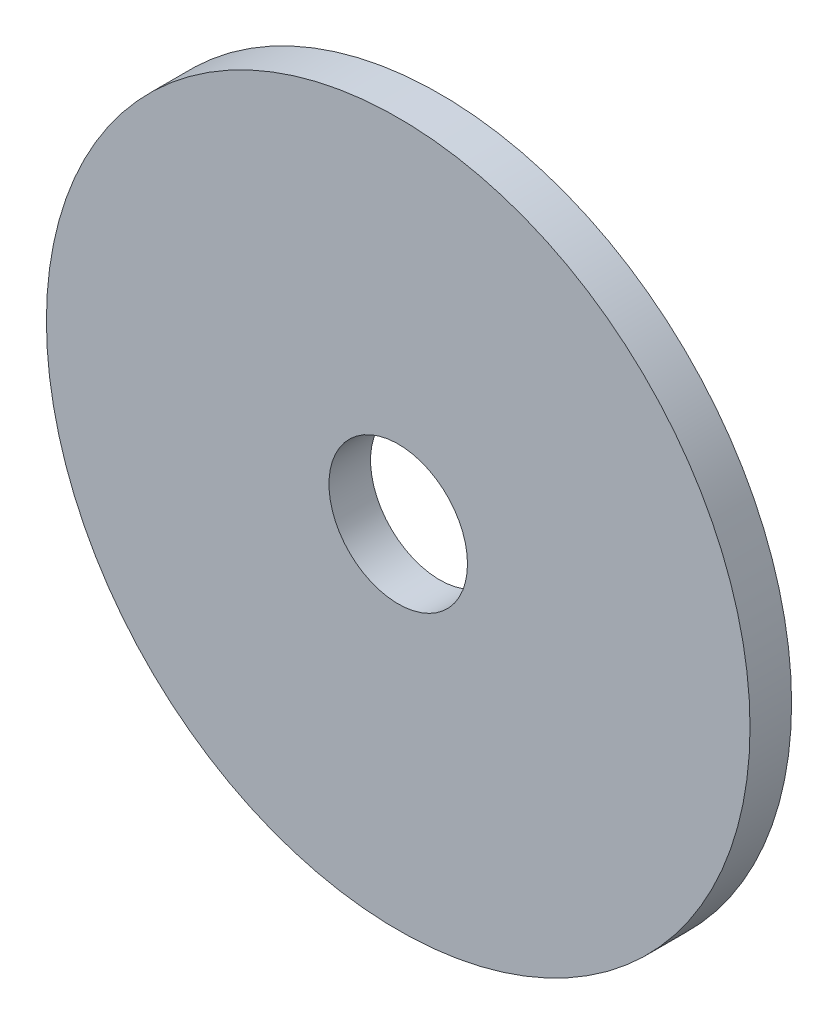
from build123d import *

# Parameters (mm, degrees)
SKETCH1_R           = 12.7
SKETCH1_R_2         = 2.5
BOSS_EXTRUDE1_DEPTH = 1.5


with BuildPart() as part:
    # Sketch1 → Boss-Extrude1 (new body)
    with BuildSketch(Plane.XY):
        Circle(SKETCH1_R)
        Circle(SKETCH1_R_2, mode=Mode.SUBTRACT)
    extrude(amount=BOSS_EXTRUDE1_DEPTH)


solid = part.part
